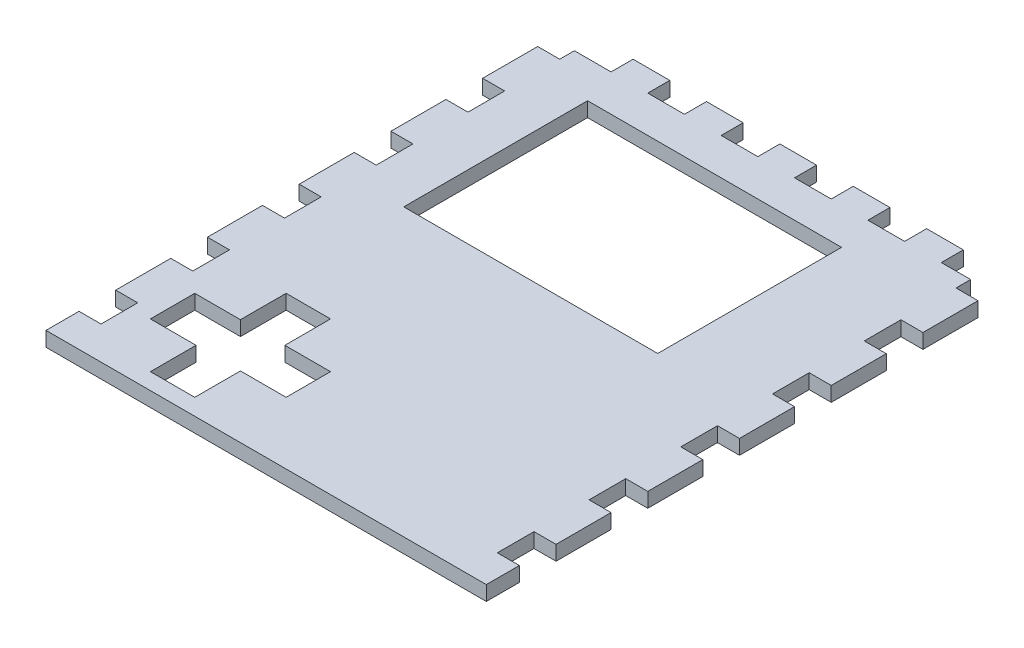
from build123d import *

# Parameters (mm, degrees)
SKETCH_1_W          = 108
SKETCH_1_H          = 138
EXTRUDE_1_DEPTH     = 4
SKETCH_2_W          = 69.21
SKETCH_2_H          = 50.1
CUT_EXTRUDE_1_DEPTH = 176.282628917
SKETCH_3_W          = 12.1
SKETCH_3_H          = 12.1
SKETCH_3_H_2        = 12.45
SKETCH_3_W_2        = 12.45
CUT_EXTRUDE_2_DEPTH = 176.282628917
SKETCH_4_W          = 15
SKETCH_4_H          = 4
EXTRUDE_2_DEPTH     = 6
SKETCH_6_W          = 9
SKETCH_6_H          = 4
EXTRUDE_3_DEPTH     = 6
SKETCH_7_W          = 15
SKETCH_7_H          = 4
EXTRUDE_4_DEPTH     = 6
SKETCH_8_W          = 9
SKETCH_8_H          = 4
EXTRUDE_5_DEPTH     = 6
SKETCH_9_W          = 10
SKETCH_9_H          = 4
EXTRUDE_6_DEPTH     = 6


with BuildPart() as part:
    # Эскиз1 → Бобышка-Вытянуть1 (new body)
    with BuildSketch(Plane(origin=(0, 0, 0), x_dir=(1, 0, 0), z_dir=(0, 1, 0))):
        with Locations((54, -69)):
            Rectangle(SKETCH_1_W, SKETCH_1_H)
    extrude(amount=EXTRUDE_1_DEPTH)

    # Эскиз2 → Вырез-Вытянуть1 (cut, through all)
    with BuildSketch(Plane(origin=(0, 4, 0), x_dir=(1, 0, 0), z_dir=(0, 1, 0))):
        with Locations((48.205, -35.05)):
            Rectangle(SKETCH_2_W, SKETCH_2_H)
    extrude(amount=-CUT_EXTRUDE_1_DEPTH, mode=Mode.SUBTRACT)

    # Эскиз3 → Вырез-Вытянуть2 (cut, through all)
    with BuildSketch(Plane(origin=(0, 4, 0), x_dir=(1, 0, 0), z_dir=(0, 1, 0))):
        with Locations((24.022320969, -115.030109588)):
            Rectangle(SKETCH_3_W, SKETCH_3_H)
        with Locations((24.022320969, -102.755109588)):
            Rectangle(SKETCH_3_W, SKETCH_3_H_2)
        with Locations((11.747320969, -115.030109588)):
            Rectangle(SKETCH_3_W_2, SKETCH_3_H)
        with Locations((36.297320969, -115.030109588)):
            Rectangle(SKETCH_3_W_2, SKETCH_3_H)
        with Locations((24.022320969, -127.305109588)):
            Rectangle(SKETCH_3_W, SKETCH_3_H_2)
    extrude(amount=-CUT_EXTRUDE_2_DEPTH, mode=Mode.SUBTRACT)

    # Эскиз4 → Бобышка-Вытянуть2 (add)
    with BuildSketch(Plane.ZY):
        with Locations((11.5, 2)):
            Rectangle(SKETCH_4_W, SKETCH_4_H)
        with Locations((36.5, 2)):
            Rectangle(SKETCH_4_W, SKETCH_4_H)
        with Locations((61.5, 2)):
            Rectangle(SKETCH_4_W, SKETCH_4_H)
        with Locations((86.5, 2)):
            Rectangle(SKETCH_4_W, SKETCH_4_H)
        with Locations((111.5, 2)):
            Rectangle(SKETCH_4_W, SKETCH_4_H)
    extrude(amount=EXTRUDE_2_DEPTH)

    # Эскиз6 → Бобышка-Вытянуть3 (add)
    with BuildSketch(Plane.ZY):
        with Locations((133.5, 2)):
            Rectangle(SKETCH_6_W, SKETCH_6_H)
    extrude(amount=EXTRUDE_3_DEPTH)

    # Эскиз7 → Бобышка-Вытянуть4 (add)
    with BuildSketch(Plane(origin=(108, 0, 0), x_dir=(0, 0, -1), z_dir=(1, 0, 0))):
        with Locations((-11.5, 2)):
            Rectangle(SKETCH_7_W, SKETCH_7_H)
        with Locations((-36.5, 2)):
            Rectangle(SKETCH_7_W, SKETCH_7_H)
        with Locations((-61.5, 2)):
            Rectangle(SKETCH_7_W, SKETCH_7_H)
        with Locations((-86.5, 2)):
            Rectangle(SKETCH_7_W, SKETCH_7_H)
        with Locations((-111.5, 2)):
            Rectangle(SKETCH_7_W, SKETCH_7_H)
    extrude(amount=EXTRUDE_4_DEPTH)

    # Эскиз8 → Бобышка-Вытянуть5 (add)
    with BuildSketch(Plane(origin=(108, 0, 0), x_dir=(0, 0, -1), z_dir=(1, 0, 0))):
        with Locations((-133.5, 2)):
            Rectangle(SKETCH_8_W, SKETCH_8_H)
    extrude(amount=EXTRUDE_5_DEPTH)

    # Эскиз9 → Бобышка-Вытянуть6 (add)
    with BuildSketch(Plane(origin=(0, 0, 0), x_dir=(-1, 0, 0), z_dir=(0, 0, -1))):
        with Locations((-94.998495411, 2)):
            Rectangle(SKETCH_9_W, SKETCH_9_H)
        with Locations((-74.998495411, 2)):
            Rectangle(SKETCH_9_W, SKETCH_9_H)
        with Locations((-54.998495411, 2)):
            Rectangle(SKETCH_9_W, SKETCH_9_H)
        with Locations((-34.998495411, 2)):
            Rectangle(SKETCH_9_W, SKETCH_9_H)
        with Locations((-14.998495411, 2)):
            Rectangle(SKETCH_9_W, SKETCH_9_H)
    extrude(amount=EXTRUDE_6_DEPTH)


solid = part.part
